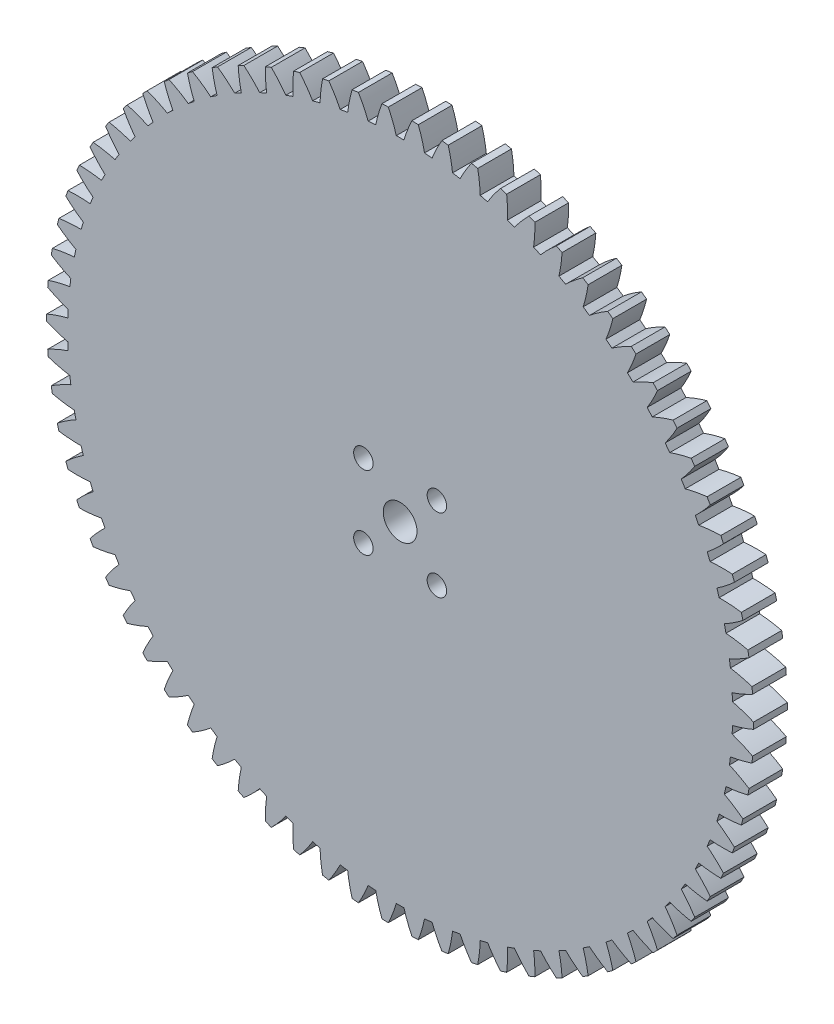
from build123d import *

# Parameters (mm, degrees)
BOSS_EXTRU_1_DEPTH      = 3.175
ENL_V_MAT_EXTRU_1_REACH = 96.233
ESQUISSE2_R             = 3.175
ESQUISSE2_R_2           = 1.83


with BuildPart() as part:
    # Esquisse1 → Boss.-Extru.1 (new, symmetric)
    with BuildSketch(Plane.XY):
        with BuildLine():
            ThreePointArc((62.531470316, -1.938169854), (64.541496389, -1.348612108), (66.497306232, -0.598551441))
            ThreePointArc((66.497306232, -0.598551441), (66.5, 0), (66.497306232, 0.598551441))
            ThreePointArc((66.497306232, 0.598551441), (64.541496389, 1.348612108), (62.531470316, 1.938169854))
            ThreePointArc((62.531470316, 1.938169854), (62.505129974, 2.655185334), (62.470568264, 3.371851574))
            ThreePointArc((62.470568264, 3.371851574), (64.423355205, 4.12974755), (66.308509633, 5.042970377))
            ThreePointArc((66.308509633, 5.042970377), (66.260432988, 5.639593978), (66.206988217, 6.235760683))
            ThreePointArc((66.206988217, 6.235760683), (64.194614612, 6.817254986), (62.141831691, 7.234226724))
            ThreePointArc((62.141831691, 7.234226724), (62.05477908, 7.94642533), (61.959564336, 8.657578734))
            ThreePointArc((61.959564336, 8.657578734), (63.841042271, 9.578352284), (65.641958703, 10.648157479))
            ThreePointArc((65.641958703, 10.648157479), (65.543458038, 11.238554551), (65.439647333, 11.828041126))
            ThreePointArc((65.439647333, 11.828041126), (63.385209166, 12.236779385), (61.304459745, 12.478160825))
            ThreePointArc((61.304459745, 12.478160825), (61.157322081, 13.18041115), (61.002140327, 13.880927841))
            ThreePointArc((61.002140327, 13.880927841), (62.798753164, 14.957944769), (64.502455955, 16.176624362))
            ThreePointArc((64.502455955, 16.176624362), (64.354240971, 16.756541082), (64.200812292, 17.335100262))
            ThreePointArc((64.200812292, 17.335100262), (62.119111835, 17.568137509), (60.025387762, 17.63218949))
            ThreePointArc((60.025387762, 17.63218949), (59.819225175, 18.319431805), (59.6051945, 19.004264545))
            ThreePointArc((59.6051945, 19.004264545), (61.303997602, 20.22976492), (62.898211535, 21.588538295))
            ThreePointArc((62.898211535, 21.588538295), (62.701350123, 22.15379635), (62.499408926, 22.717259603))
            ThreePointArc((62.499408926, 22.717259603), (60.40544488, 22.772916799), (58.313831485, 22.659177827))
            ThreePointArc((58.313831485, 22.659177827), (58.050129381, 23.326460535), (57.77879188, 23.990675087))
            ThreePointArc((57.77879188, 23.990675087), (59.367545333, 25.35582915), (60.840784059, 26.844906316))
            ThreePointArc((60.840784059, 26.844906316), (60.596694611, 27.391433008), (60.347695887, 27.935740568))
            ThreePointArc((60.347695887, 27.935740568), (58.256555311, 27.813616702), (56.182122715, 27.522906268))
            ThreePointArc((56.182122715, 27.522906268), (55.862781075, 28.165421581), (55.536091741, 28.804232266))
            ThreePointArc((55.536091741, 28.804232266), (57.003348538, 30.299204051), (58.34499734, 31.907856171))
            ThreePointArc((58.34499734, 31.907856171), (58.055438525, 32.431713764), (57.761176317, 32.952943882))
            ThreePointArc((57.761176317, 32.952943882), (55.687925925, 32.653918859), (53.645620464, 32.188331539))
            ThreePointArc((53.645620464, 32.188331539), (53.27294015, 32.80145012), (52.893252788, 33.410254291))
            ThreePointArc((52.893252788, 33.410254291), (54.228441312, 35.024272492), (55.428833578, 36.740909192))
            ThreePointArc((55.428833578, 36.740909192), (55.095891675, 37.238323278), (54.758486147, 37.732720481))
            ThreePointArc((54.758486147, 37.732720481), (52.718063758, 37.258948782), (50.722600289, 36.621839143))
            ThreePointArc((50.722600289, 36.621839143), (50.299266471, 37.201143459), (49.869316736, 37.775554668))
            ThreePointArc((49.869316736, 37.775554668), (51.062816923, 39.496990248), (52.113303799, 41.309243119))
            ThreePointArc((52.113303799, 41.309243119), (51.739377662, 41.77662982), (51.36125983, 42.240631964))
            ThreePointArc((51.36125983, 42.240631964), (49.368366733, 41.595527126), (47.434122615, 40.791485557))
            ThreePointArc((47.434122615, 40.791485557), (46.963185425, 41.332801707), (46.486071115, 41.868681309))
            ThreePointArc((46.486071115, 41.868681309), (47.529283768, 43.685131283), (48.422296473, 45.579943004))
            ThreePointArc((48.422296473, 45.579943004), (48.010080248, 46.013934787), (47.593974459, 46.444198725))
            ThreePointArc((47.593974459, 46.444198725), (45.662969494, 45.632408743), (43.803881002, 44.667228383))
            ThreePointArc((43.803881002, 44.667228383), (43.288733552, 45.166656172), (42.767892287, 45.660143141))
            ThreePointArc((42.767892287, 45.660143141), (43.653301034, 47.558519947), (44.382405391, 49.522238355))
            ThreePointArc((44.382405391, 49.522238355), (43.934869105, 49.919708299), (43.483773411, 50.31313397))
            ThreePointArc((43.483773411, 50.31313397), (41.628569514, 49.34050781), (39.858031422, 48.221142805))
            ThreePointArc((39.858031422, 48.221142805), (39.302385361, 48.675083844), (38.741569814, 49.122622595))
            ThreePointArc((38.741569814, 49.122622595), (39.462795266, 51.089248385), (40.022738062, 53.107724843))
            ThreePointArc((40.022738062, 53.107724843), (39.543106224, 53.465809169), (39.06027078, 53.819561933))
            ThreePointArc((39.06027078, 53.819561933), (37.294234736, 52.693107388), (35.625003812, 51.427622788))
            ThreePointArc((35.625003812, 51.427622788), (35.032862583, 51.832806421), (34.436113443, 52.231172428))
            ThreePointArc((34.436113443, 52.231172428), (34.987959154, 54.251877617), (35.374705987, 56.310568958))
            ThreePointArc((35.374705987, 56.310568958), (34.866434357, 56.626687659), (34.355338002, 56.938218718))
            ThreePointArc((34.355338002, 56.938218718), (32.691194142, 55.666051919), (31.135297233, 54.263565571))
            ThreePointArc((31.135297233, 54.263565571), (30.510927227, 54.617072441), (29.882544085, 54.963395467))
            ThreePointArc((29.882544085, 54.963395467), (30.261033995, 57.023620828), (30.471798345, 59.107694132))
            ThreePointArc((30.471798345, 59.107694132), (29.93854903, 59.379569567), (29.402874227, 59.646634333))
            ThreePointArc((29.402874227, 59.646634333), (27.852612746, 58.237921271), (26.421260125, 56.70853812))
            ThreePointArc((26.421260125, 56.70853812), (25.769159942, 57.007821201), (25.113670313, 57.299605982))
            ThreePointArc((25.113670313, 57.299605982), (25.316077392, 59.384507544), (25.349340698, 61.478947016))
            ThreePointArc((25.349340698, 61.478947016), (24.794955772, 61.704620315), (24.238562069, 61.92529458))
            ThreePointArc((24.238562069, 61.92529458), (22.813352637, 60.390185065), (21.516857232, 58.744924352))
            ThreePointArc((21.516857232, 58.744924352), (20.841725269, 58.987827304), (20.163851971, 59.222971522))
            ThreePointArc((20.163851971, 59.222971522), (20.188717871, 61.317527522), (20.04424047, 63.407242677))
            ThreePointArc((20.04424047, 63.407242677), (19.47271429, 63.58508786), (18.899610516, 63.757781661))
            ThreePointArc((18.899610516, 63.757781661), (17.609721799, 62.107336192), (16.457424889, 60.358052058))
            ThreePointArc((16.457424889, 60.358052058), (15.764125487, 60.54282476), (15.068752613, 60.719634196))
            ThreePointArc((15.068752613, 60.719634196), (14.915898176, 62.80875331), (14.594721031, 64.878687703))
            ThreePointArc((14.594721031, 64.878687703), (14.010171455, 65.00742339), (13.424486837, 65.130892464))
            ThreePointArc((13.424486837, 65.130892464), (12.279212512, 63.377002539), (11.279416423, 61.536298616))
            ThreePointArc((11.279416423, 61.536298616), (10.572944821, 61.661609775), (9.865082547, 61.778810515))
            ThreePointArc((9.865082547, 61.778810515), (9.535609092, 63.847440591), (9.040046292, 65.882680296))
            ThreePointArc((9.040046292, 65.882680296), (8.446685013, 65.961378945), (7.852639422, 66.034733695))
            ThreePointArc((7.852639422, 66.034733695), (6.860231217, 64.19003613), (6.020139503, 62.271174733))
            ThreePointArc((6.020139503, 62.271174733), (5.305585844, 62.336121479), (4.590334336, 62.392869087))
            ThreePointArc((4.590334336, 62.392869087), (4.086615726, 64.426105599), (3.420237812, 66.411986669))
            ThreePointArc((3.420237812, 66.411986669), (2.822340013, 66.440081253), (2.22421356, 66.462793156))
            ThreePointArc((2.22421356, 66.462793156), (1.391821799, 64.54057904), (0.71748734, 62.557385608))
            ThreePointArc((0.71748734, 62.557385608), (0, 62.5615), (-0.71748734, 62.557385608))
            ThreePointArc((-0.71748734, 62.557385608), (-1.391821799, 64.54057904), (-2.22421356, 66.462793156))
            ThreePointArc((-2.22421356, 66.462793156), (-2.822340013, 66.440081253), (-3.420237812, 66.411986669))
            ThreePointArc((-3.420237812, 66.411986669), (-4.086615726, 64.426105599), (-4.590334336, 62.392869087))
            ThreePointArc((-4.590334336, 62.392869087), (-5.305585844, 62.336121479), (-6.020139503, 62.271174733))
            ThreePointArc((-6.020139503, 62.271174733), (-6.860231217, 64.19003613), (-7.852639422, 66.034733695))
            ThreePointArc((-7.852639422, 66.034733695), (-8.446685013, 65.961378945), (-9.040046292, 65.882680296))
            ThreePointArc((-9.040046292, 65.882680296), (-9.535609092, 63.847440591), (-9.865082547, 61.778810515))
            ThreePointArc((-9.865082547, 61.778810515), (-10.572944821, 61.661609775), (-11.279416423, 61.536298616))
            ThreePointArc((-11.279416423, 61.536298616), (-12.279212512, 63.377002539), (-13.424486837, 65.130892464))
            ThreePointArc((-13.424486837, 65.130892464), (-14.010171455, 65.00742339), (-14.594721031, 64.878687703))
            ThreePointArc((-14.594721031, 64.878687703), (-14.915898176, 62.80875331), (-15.068752613, 60.719634196))
            ThreePointArc((-15.068752613, 60.719634196), (-15.764125487, 60.54282476), (-16.457424889, 60.358052058))
            ThreePointArc((-16.457424889, 60.358052058), (-17.609721799, 62.107336192), (-18.899610516, 63.757781661))
            ThreePointArc((-18.899610516, 63.757781661), (-19.47271429, 63.58508786), (-20.04424047, 63.407242677))
            ThreePointArc((-20.04424047, 63.407242677), (-20.188717871, 61.317527522), (-20.163851971, 59.222971522))
            ThreePointArc((-20.163851971, 59.222971522), (-20.841725269, 58.987827304), (-21.516857232, 58.744924352))
            ThreePointArc((-21.516857232, 58.744924352), (-22.813352637, 60.390185065), (-24.238562069, 61.92529458))
            ThreePointArc((-24.238562069, 61.92529458), (-24.794955772, 61.704620315), (-25.349340698, 61.478947016))
            ThreePointArc((-25.349340698, 61.478947016), (-25.316077392, 59.384507544), (-25.113670313, 57.299605982))
            ThreePointArc((-25.113670313, 57.299605982), (-25.769159942, 57.007821201), (-26.421260125, 56.70853812))
            ThreePointArc((-26.421260125, 56.70853812), (-27.852612746, 58.237921271), (-29.402874227, 59.646634333))
            ThreePointArc((-29.402874227, 59.646634333), (-29.93854903, 59.379569567), (-30.471798345, 59.107694132))
            ThreePointArc((-30.471798345, 59.107694132), (-30.261033995, 57.023620828), (-29.882544085, 54.963395467))
            ThreePointArc((-29.882544085, 54.963395467), (-30.510927227, 54.617072441), (-31.135297233, 54.263565571))
            ThreePointArc((-31.135297233, 54.263565571), (-32.691194142, 55.666051919), (-34.355338002, 56.938218718))
            ThreePointArc((-34.355338002, 56.938218718), (-34.866434357, 56.626687659), (-35.374705987, 56.310568958))
            ThreePointArc((-35.374705987, 56.310568958), (-34.987959154, 54.251877617), (-34.436113443, 52.231172428))
            ThreePointArc((-34.436113443, 52.231172428), (-35.032862583, 51.832806421), (-35.625003812, 51.427622788))
            ThreePointArc((-35.625003812, 51.427622788), (-37.294234736, 52.693107388), (-39.06027078, 53.819561933))
            ThreePointArc((-39.06027078, 53.819561933), (-39.543106224, 53.465809169), (-40.022738062, 53.107724843))
            ThreePointArc((-40.022738062, 53.107724843), (-39.462795266, 51.089248385), (-38.741569814, 49.122622595))
            ThreePointArc((-38.741569814, 49.122622595), (-39.302385361, 48.675083844), (-39.858031422, 48.221142805))
            ThreePointArc((-39.858031422, 48.221142805), (-41.628569514, 49.34050781), (-43.483773411, 50.31313397))
            ThreePointArc((-43.483773411, 50.31313397), (-43.934869105, 49.919708299), (-44.382405391, 49.522238355))
            ThreePointArc((-44.382405391, 49.522238355), (-43.653301034, 47.558519947), (-42.767892287, 45.660143141))
            ThreePointArc((-42.767892287, 45.660143141), (-43.288733552, 45.166656172), (-43.803881002, 44.667228383))
            ThreePointArc((-43.803881002, 44.667228383), (-45.662969494, 45.632408743), (-47.593974459, 46.444198725))
            ThreePointArc((-47.593974459, 46.444198725), (-48.010080248, 46.013934787), (-48.422296473, 45.579943004))
            ThreePointArc((-48.422296473, 45.579943004), (-47.529283768, 43.685131283), (-46.486071115, 41.868681309))
            ThreePointArc((-46.486071115, 41.868681309), (-46.963185425, 41.332801707), (-47.434122615, 40.791485557))
            ThreePointArc((-47.434122615, 40.791485557), (-49.368366733, 41.595527126), (-51.36125983, 42.240631964))
            ThreePointArc((-51.36125983, 42.240631964), (-51.739377662, 41.77662982), (-52.113303799, 41.309243119))
            ThreePointArc((-52.113303799, 41.309243119), (-51.062816923, 39.496990248), (-49.869316736, 37.775554668))
            ThreePointArc((-49.869316736, 37.775554668), (-50.299266471, 37.201143459), (-50.722600289, 36.621839143))
            ThreePointArc((-50.722600289, 36.621839143), (-52.718063758, 37.258948782), (-54.758486147, 37.732720481))
            ThreePointArc((-54.758486147, 37.732720481), (-55.095891675, 37.238323278), (-55.428833578, 36.740909192))
            ThreePointArc((-55.428833578, 36.740909192), (-54.228441312, 35.024272492), (-52.893252788, 33.410254291))
            ThreePointArc((-52.893252788, 33.410254291), (-53.27294015, 32.80145012), (-53.645620464, 32.188331539))
            ThreePointArc((-53.645620464, 32.188331539), (-55.687925925, 32.653918859), (-57.761176317, 32.952943882))
            ThreePointArc((-57.761176317, 32.952943882), (-58.055438525, 32.431713764), (-58.34499734, 31.907856171))
            ThreePointArc((-58.34499734, 31.907856171), (-57.003348538, 30.299204051), (-55.536091741, 28.804232266))
            ThreePointArc((-55.536091741, 28.804232266), (-55.862781075, 28.165421581), (-56.182122715, 27.522906268))
            ThreePointArc((-56.182122715, 27.522906268), (-58.256555311, 27.813616702), (-60.347695887, 27.935740568))
            ThreePointArc((-60.347695887, 27.935740568), (-60.596694611, 27.391433008), (-60.840784059, 26.844906316))
            ThreePointArc((-60.840784059, 26.844906316), (-59.367545333, 25.35582915), (-57.77879188, 23.990675087))
            ThreePointArc((-57.77879188, 23.990675087), (-58.050129381, 23.326460535), (-58.313831485, 22.659177827))
            ThreePointArc((-58.313831485, 22.659177827), (-60.40544488, 22.772916799), (-62.499408926, 22.717259603))
            ThreePointArc((-62.499408926, 22.717259603), (-62.701350123, 22.15379635), (-62.898211535, 21.588538295))
            ThreePointArc((-62.898211535, 21.588538295), (-61.303997602, 20.22976492), (-59.6051945, 19.004264545))
            ThreePointArc((-59.6051945, 19.004264545), (-59.819225175, 18.319431805), (-60.025387762, 17.63218949))
            ThreePointArc((-60.025387762, 17.63218949), (-62.119111835, 17.568137509), (-64.200812292, 17.335100262))
            ThreePointArc((-64.200812292, 17.335100262), (-64.354240971, 16.756541082), (-64.502455955, 16.176624362))
            ThreePointArc((-64.502455955, 16.176624362), (-62.798753164, 14.957944769), (-61.002140327, 13.880927841))
            ThreePointArc((-61.002140327, 13.880927841), (-61.157322081, 13.18041115), (-61.304459745, 12.478160825))
            ThreePointArc((-61.304459745, 12.478160825), (-63.385209166, 12.236779385), (-65.439647333, 11.828041126))
            ThreePointArc((-65.439647333, 11.828041126), (-65.543458038, 11.238554551), (-65.641958703, 10.648157479))
            ThreePointArc((-65.641958703, 10.648157479), (-63.841042271, 9.578352284), (-61.959564336, 8.657578734))
            ThreePointArc((-61.959564336, 8.657578734), (-62.05477908, 7.94642533), (-62.141831691, 7.234226724))
            ThreePointArc((-62.141831691, 7.234226724), (-64.194614612, 6.817254986), (-66.206988217, 6.235760683))
            ThreePointArc((-66.206988217, 6.235760683), (-66.260432988, 5.639593978), (-66.308509633, 5.042970377))
            ThreePointArc((-66.308509633, 5.042970377), (-64.423355205, 4.12974755), (-62.470568264, 3.371851574))
            ThreePointArc((-62.470568264, 3.371851574), (-62.505129974, 2.655185334), (-62.531470316, 1.938169854))
            ThreePointArc((-62.531470316, 1.938169854), (-64.541496389, 1.348612108), (-66.497306232, 0.598551441))
            ThreePointArc((-66.497306232, 0.598551441), (-66.5, 0), (-66.497306232, -0.598551441))
            ThreePointArc((-66.497306232, -0.598551441), (-64.541496389, -1.348612108), (-62.531470316, -1.938169854))
            ThreePointArc((-62.531470316, -1.938169854), (-62.505129974, -2.655185334), (-62.470568264, -3.371851574))
            ThreePointArc((-62.470568264, -3.371851574), (-64.423355205, -4.12974755), (-66.308509633, -5.042970377))
            ThreePointArc((-66.308509633, -5.042970377), (-66.260432988, -5.639593978), (-66.206988217, -6.235760683))
            ThreePointArc((-66.206988217, -6.235760683), (-64.194614612, -6.817254986), (-62.141831691, -7.234226724))
            ThreePointArc((-62.141831691, -7.234226724), (-62.05477908, -7.94642533), (-61.959564336, -8.657578734))
            ThreePointArc((-61.959564336, -8.657578734), (-63.841042271, -9.578352284), (-65.641958703, -10.648157479))
            ThreePointArc((-65.641958703, -10.648157479), (-65.543458038, -11.238554551), (-65.439647333, -11.828041126))
            ThreePointArc((-65.439647333, -11.828041126), (-63.385209166, -12.236779385), (-61.304459745, -12.478160825))
            ThreePointArc((-61.304459745, -12.478160825), (-61.157322081, -13.18041115), (-61.002140327, -13.880927841))
            ThreePointArc((-61.002140327, -13.880927841), (-62.798753164, -14.957944769), (-64.502455955, -16.176624362))
            ThreePointArc((-64.502455955, -16.176624362), (-64.354240971, -16.756541082), (-64.200812292, -17.335100262))
            ThreePointArc((-64.200812292, -17.335100262), (-62.119111835, -17.568137509), (-60.025387762, -17.63218949))
            ThreePointArc((-60.025387762, -17.63218949), (-59.819225175, -18.319431805), (-59.6051945, -19.004264545))
            ThreePointArc((-59.6051945, -19.004264545), (-61.303997602, -20.22976492), (-62.898211535, -21.588538295))
            ThreePointArc((-62.898211535, -21.588538295), (-62.701350123, -22.15379635), (-62.499408926, -22.717259603))
            ThreePointArc((-62.499408926, -22.717259603), (-60.40544488, -22.772916799), (-58.313831485, -22.659177827))
            ThreePointArc((-58.313831485, -22.659177827), (-58.050129381, -23.326460535), (-57.77879188, -23.990675087))
            ThreePointArc((-57.77879188, -23.990675087), (-59.367545333, -25.35582915), (-60.840784059, -26.844906316))
            ThreePointArc((-60.840784059, -26.844906316), (-60.596694611, -27.391433008), (-60.347695887, -27.935740568))
            ThreePointArc((-60.347695887, -27.935740568), (-58.256555311, -27.813616702), (-56.182122715, -27.522906268))
            ThreePointArc((-56.182122715, -27.522906268), (-55.862781075, -28.165421581), (-55.536091741, -28.804232266))
            ThreePointArc((-55.536091741, -28.804232266), (-57.003348538, -30.299204051), (-58.34499734, -31.907856171))
            ThreePointArc((-58.34499734, -31.907856171), (-58.055438525, -32.431713764), (-57.761176317, -32.952943882))
            ThreePointArc((-57.761176317, -32.952943882), (-55.687925925, -32.653918859), (-53.645620464, -32.188331539))
            ThreePointArc((-53.645620464, -32.188331539), (-53.27294015, -32.80145012), (-52.893252788, -33.410254291))
            ThreePointArc((-52.893252788, -33.410254291), (-54.228441312, -35.024272492), (-55.428833578, -36.740909192))
            ThreePointArc((-55.428833578, -36.740909192), (-55.095891675, -37.238323278), (-54.758486147, -37.732720481))
            ThreePointArc((-54.758486147, -37.732720481), (-52.718063758, -37.258948782), (-50.722600289, -36.621839143))
            ThreePointArc((-50.722600289, -36.621839143), (-50.299266471, -37.201143459), (-49.869316736, -37.775554668))
            ThreePointArc((-49.869316736, -37.775554668), (-51.062816923, -39.496990248), (-52.113303799, -41.309243119))
            ThreePointArc((-52.113303799, -41.309243119), (-51.739377662, -41.77662982), (-51.36125983, -42.240631964))
            ThreePointArc((-51.36125983, -42.240631964), (-49.368366733, -41.595527126), (-47.434122615, -40.791485557))
            ThreePointArc((-47.434122615, -40.791485557), (-46.963185425, -41.332801707), (-46.486071115, -41.868681309))
            ThreePointArc((-46.486071115, -41.868681309), (-47.529283768, -43.685131283), (-48.422296473, -45.579943004))
            ThreePointArc((-48.422296473, -45.579943004), (-48.010080248, -46.013934787), (-47.593974459, -46.444198725))
            ThreePointArc((-47.593974459, -46.444198725), (-45.662969494, -45.632408743), (-43.803881002, -44.667228383))
            ThreePointArc((-43.803881002, -44.667228383), (-43.288733552, -45.166656172), (-42.767892287, -45.660143141))
            ThreePointArc((-42.767892287, -45.660143141), (-43.653301034, -47.558519947), (-44.382405391, -49.522238355))
            ThreePointArc((-44.382405391, -49.522238355), (-43.934869105, -49.919708299), (-43.483773411, -50.31313397))
            ThreePointArc((-43.483773411, -50.31313397), (-41.628569514, -49.34050781), (-39.858031422, -48.221142805))
            ThreePointArc((-39.858031422, -48.221142805), (-39.302385361, -48.675083844), (-38.741569814, -49.122622595))
            ThreePointArc((-38.741569814, -49.122622595), (-39.462795266, -51.089248385), (-40.022738062, -53.107724843))
            ThreePointArc((-40.022738062, -53.107724843), (-39.543106224, -53.465809169), (-39.06027078, -53.819561933))
            ThreePointArc((-39.06027078, -53.819561933), (-37.294234736, -52.693107388), (-35.625003812, -51.427622788))
            ThreePointArc((-35.625003812, -51.427622788), (-35.032862583, -51.832806421), (-34.436113443, -52.231172428))
            ThreePointArc((-34.436113443, -52.231172428), (-34.987959154, -54.251877617), (-35.374705987, -56.310568958))
            ThreePointArc((-35.374705987, -56.310568958), (-34.866434357, -56.626687659), (-34.355338002, -56.938218718))
            ThreePointArc((-34.355338002, -56.938218718), (-32.691194142, -55.666051919), (-31.135297233, -54.263565571))
            ThreePointArc((-31.135297233, -54.263565571), (-30.510927227, -54.617072441), (-29.882544085, -54.963395467))
            ThreePointArc((-29.882544085, -54.963395467), (-30.261033995, -57.023620828), (-30.471798345, -59.107694132))
            ThreePointArc((-30.471798345, -59.107694132), (-29.93854903, -59.379569567), (-29.402874227, -59.646634333))
            ThreePointArc((-29.402874227, -59.646634333), (-27.852612746, -58.237921271), (-26.421260125, -56.70853812))
            ThreePointArc((-26.421260125, -56.70853812), (-25.769159942, -57.007821201), (-25.113670313, -57.299605982))
            ThreePointArc((-25.113670313, -57.299605982), (-25.316077392, -59.384507544), (-25.349340698, -61.478947016))
            ThreePointArc((-25.349340698, -61.478947016), (-24.794955772, -61.704620315), (-24.238562069, -61.92529458))
            ThreePointArc((-24.238562069, -61.92529458), (-22.813352637, -60.390185065), (-21.516857232, -58.744924352))
            ThreePointArc((-21.516857232, -58.744924352), (-20.841725269, -58.987827304), (-20.163851971, -59.222971522))
            ThreePointArc((-20.163851971, -59.222971522), (-20.188717871, -61.317527522), (-20.04424047, -63.407242677))
            ThreePointArc((-20.04424047, -63.407242677), (-19.47271429, -63.58508786), (-18.899610516, -63.757781661))
            ThreePointArc((-18.899610516, -63.757781661), (-17.609721799, -62.107336192), (-16.457424889, -60.358052058))
            ThreePointArc((-16.457424889, -60.358052058), (-15.764125487, -60.54282476), (-15.068752613, -60.719634196))
            ThreePointArc((-15.068752613, -60.719634196), (-14.915898176, -62.80875331), (-14.594721031, -64.878687703))
            ThreePointArc((-14.594721031, -64.878687703), (-14.010171455, -65.00742339), (-13.424486837, -65.130892464))
            ThreePointArc((-13.424486837, -65.130892464), (-12.279212512, -63.377002539), (-11.279416423, -61.536298616))
            ThreePointArc((-11.279416423, -61.536298616), (-10.572944821, -61.661609775), (-9.865082547, -61.778810515))
            ThreePointArc((-9.865082547, -61.778810515), (-9.535609092, -63.847440591), (-9.040046292, -65.882680296))
            ThreePointArc((-9.040046292, -65.882680296), (-8.446685013, -65.961378945), (-7.852639422, -66.034733695))
            ThreePointArc((-7.852639422, -66.034733695), (-6.860231217, -64.19003613), (-6.020139503, -62.271174733))
            ThreePointArc((-6.020139503, -62.271174733), (-5.305585844, -62.336121479), (-4.590334336, -62.392869087))
            ThreePointArc((-4.590334336, -62.392869087), (-4.086615726, -64.426105599), (-3.420237812, -66.411986669))
            ThreePointArc((-3.420237812, -66.411986669), (-2.822340013, -66.440081253), (-2.22421356, -66.462793156))
            ThreePointArc((-2.22421356, -66.462793156), (-1.391821799, -64.54057904), (-0.71748734, -62.557385608))
            ThreePointArc((-0.71748734, -62.557385608), (0, -62.5615), (0.71748734, -62.557385608))
            ThreePointArc((0.71748734, -62.557385608), (1.391821799, -64.54057904), (2.22421356, -66.462793156))
            ThreePointArc((2.22421356, -66.462793156), (2.822340013, -66.440081253), (3.420237812, -66.411986669))
            ThreePointArc((3.420237812, -66.411986669), (4.086615726, -64.426105599), (4.590334336, -62.392869087))
            ThreePointArc((4.590334336, -62.392869087), (5.305585844, -62.336121479), (6.020139503, -62.271174733))
            ThreePointArc((6.020139503, -62.271174733), (6.860231217, -64.19003613), (7.852639422, -66.034733695))
            ThreePointArc((7.852639422, -66.034733695), (8.446685013, -65.961378945), (9.040046292, -65.882680296))
            ThreePointArc((9.040046292, -65.882680296), (9.535609092, -63.847440591), (9.865082547, -61.778810515))
            ThreePointArc((9.865082547, -61.778810515), (10.572944821, -61.661609775), (11.279416423, -61.536298616))
            ThreePointArc((11.279416423, -61.536298616), (12.279212512, -63.377002539), (13.424486837, -65.130892464))
            ThreePointArc((13.424486837, -65.130892464), (14.010171455, -65.00742339), (14.594721031, -64.878687703))
            ThreePointArc((14.594721031, -64.878687703), (14.915898176, -62.80875331), (15.068752613, -60.719634196))
            ThreePointArc((15.068752613, -60.719634196), (15.764125487, -60.54282476), (16.457424889, -60.358052058))
            ThreePointArc((16.457424889, -60.358052058), (17.609721799, -62.107336192), (18.899610516, -63.757781661))
            ThreePointArc((18.899610516, -63.757781661), (19.47271429, -63.58508786), (20.04424047, -63.407242677))
            ThreePointArc((20.04424047, -63.407242677), (20.188717871, -61.317527522), (20.163851971, -59.222971522))
            ThreePointArc((20.163851971, -59.222971522), (20.841725269, -58.987827304), (21.516857232, -58.744924352))
            ThreePointArc((21.516857232, -58.744924352), (22.813352637, -60.390185065), (24.238562069, -61.92529458))
            ThreePointArc((24.238562069, -61.92529458), (24.794955772, -61.704620315), (25.349340698, -61.478947016))
            ThreePointArc((25.349340698, -61.478947016), (25.316077392, -59.384507544), (25.113670313, -57.299605982))
            ThreePointArc((25.113670313, -57.299605982), (25.769159942, -57.007821201), (26.421260125, -56.70853812))
            ThreePointArc((26.421260125, -56.70853812), (27.852612746, -58.237921271), (29.402874227, -59.646634333))
            ThreePointArc((29.402874227, -59.646634333), (29.93854903, -59.379569567), (30.471798345, -59.107694132))
            ThreePointArc((30.471798345, -59.107694132), (30.261033995, -57.023620828), (29.882544085, -54.963395467))
            ThreePointArc((29.882544085, -54.963395467), (30.510927227, -54.617072441), (31.135297233, -54.263565571))
            ThreePointArc((31.135297233, -54.263565571), (32.691194142, -55.666051919), (34.355338002, -56.938218718))
            ThreePointArc((34.355338002, -56.938218718), (34.866434357, -56.626687659), (35.374705987, -56.310568958))
            ThreePointArc((35.374705987, -56.310568958), (34.987959154, -54.251877617), (34.436113443, -52.231172428))
            ThreePointArc((34.436113443, -52.231172428), (35.032862583, -51.832806421), (35.625003812, -51.427622788))
            ThreePointArc((35.625003812, -51.427622788), (37.294234736, -52.693107388), (39.06027078, -53.819561933))
            ThreePointArc((39.06027078, -53.819561933), (39.543106224, -53.465809169), (40.022738062, -53.107724843))
            ThreePointArc((40.022738062, -53.107724843), (39.462795266, -51.089248385), (38.741569814, -49.122622595))
            ThreePointArc((38.741569814, -49.122622595), (39.302385361, -48.675083844), (39.858031422, -48.221142805))
            ThreePointArc((39.858031422, -48.221142805), (41.628569514, -49.34050781), (43.483773411, -50.31313397))
            ThreePointArc((43.483773411, -50.31313397), (43.934869105, -49.919708299), (44.382405391, -49.522238355))
            ThreePointArc((44.382405391, -49.522238355), (43.653301034, -47.558519947), (42.767892287, -45.660143141))
            ThreePointArc((42.767892287, -45.660143141), (43.288733552, -45.166656172), (43.803881002, -44.667228383))
            ThreePointArc((43.803881002, -44.667228383), (45.662969494, -45.632408743), (47.593974459, -46.444198725))
            ThreePointArc((47.593974459, -46.444198725), (48.010080248, -46.013934787), (48.422296473, -45.579943004))
            ThreePointArc((48.422296473, -45.579943004), (47.529283768, -43.685131283), (46.486071115, -41.868681309))
            ThreePointArc((46.486071115, -41.868681309), (46.963185425, -41.332801707), (47.434122615, -40.791485557))
            ThreePointArc((47.434122615, -40.791485557), (49.368366733, -41.595527126), (51.36125983, -42.240631964))
            ThreePointArc((51.36125983, -42.240631964), (51.739377662, -41.77662982), (52.113303799, -41.309243119))
            ThreePointArc((52.113303799, -41.309243119), (51.062816923, -39.496990248), (49.869316736, -37.775554668))
            ThreePointArc((49.869316736, -37.775554668), (50.299266471, -37.201143459), (50.722600289, -36.621839143))
            ThreePointArc((50.722600289, -36.621839143), (52.718063758, -37.258948782), (54.758486147, -37.732720481))
            ThreePointArc((54.758486147, -37.732720481), (55.095891675, -37.238323278), (55.428833578, -36.740909192))
            ThreePointArc((55.428833578, -36.740909192), (54.228441312, -35.024272492), (52.893252788, -33.410254291))
            ThreePointArc((52.893252788, -33.410254291), (53.27294015, -32.80145012), (53.645620464, -32.188331539))
            ThreePointArc((53.645620464, -32.188331539), (55.687925925, -32.653918859), (57.761176317, -32.952943882))
            ThreePointArc((57.761176317, -32.952943882), (58.055438525, -32.431713764), (58.34499734, -31.907856171))
            ThreePointArc((58.34499734, -31.907856171), (57.003348538, -30.299204051), (55.536091741, -28.804232266))
            ThreePointArc((55.536091741, -28.804232266), (55.862781075, -28.165421581), (56.182122715, -27.522906268))
            ThreePointArc((56.182122715, -27.522906268), (58.256555311, -27.813616702), (60.347695887, -27.935740568))
            ThreePointArc((60.347695887, -27.935740568), (60.596694611, -27.391433008), (60.840784059, -26.844906316))
            ThreePointArc((60.840784059, -26.844906316), (59.367545333, -25.35582915), (57.77879188, -23.990675087))
            ThreePointArc((57.77879188, -23.990675087), (58.050129381, -23.326460535), (58.313831485, -22.659177827))
            ThreePointArc((58.313831485, -22.659177827), (60.40544488, -22.772916799), (62.499408926, -22.717259603))
            ThreePointArc((62.499408926, -22.717259603), (62.701350123, -22.15379635), (62.898211535, -21.588538295))
            ThreePointArc((62.898211535, -21.588538295), (61.303997602, -20.22976492), (59.6051945, -19.004264545))
            ThreePointArc((59.6051945, -19.004264545), (59.819225175, -18.319431805), (60.025387762, -17.63218949))
            ThreePointArc((60.025387762, -17.63218949), (62.119111835, -17.568137509), (64.200812292, -17.335100262))
            ThreePointArc((64.200812292, -17.335100262), (64.354240971, -16.756541082), (64.502455955, -16.176624362))
            ThreePointArc((64.502455955, -16.176624362), (62.798753164, -14.957944769), (61.002140327, -13.880927841))
            ThreePointArc((61.002140327, -13.880927841), (61.157322081, -13.18041115), (61.304459745, -12.478160825))
            ThreePointArc((61.304459745, -12.478160825), (63.385209166, -12.236779385), (65.439647333, -11.828041126))
            ThreePointArc((65.439647333, -11.828041126), (65.543458038, -11.238554551), (65.641958703, -10.648157479))
            ThreePointArc((65.641958703, -10.648157479), (63.841042271, -9.578352284), (61.959564336, -8.657578734))
            ThreePointArc((61.959564336, -8.657578734), (62.05477908, -7.94642533), (62.141831691, -7.234226724))
            ThreePointArc((62.141831691, -7.234226724), (64.194614612, -6.817254986), (66.206988217, -6.235760683))
            ThreePointArc((66.206988217, -6.235760683), (66.260432988, -5.639593978), (66.308509633, -5.042970377))
            ThreePointArc((66.308509633, -5.042970377), (64.423355205, -4.12974755), (62.470568264, -3.371851574))
            ThreePointArc((62.470568264, -3.371851574), (62.505129974, -2.655185334), (62.531470316, -1.938169854))
        make_face()
    extrude(amount=BOSS_EXTRU_1_DEPTH, both=True)

    # Esquisse2 → Enlèv. mat.-Extru.1 (cut, up to next)
    with BuildSketch(Plane.XY.offset(3.175), mode=Mode.PRIVATE) as enl_v_mat_extru_1_sk1:
        Circle(ESQUISSE2_R)
    enl_v_mat_extru_1_tool1 = extrude(enl_v_mat_extru_1_sk1.sketch, amount=-ENL_V_MAT_EXTRU_1_REACH, mode=Mode.PRIVATE) & part.part
    # Esquisse2 → Enlèv. mat.-Extru.1 (cut, up to next)
    with BuildSketch(Plane.XY.offset(3.175), mode=Mode.PRIVATE) as enl_v_mat_extru_1_sk2:
        with Locations((6.914797213, 6.914797213)):
            Circle(ESQUISSE2_R_2)
    enl_v_mat_extru_1_tool2 = extrude(enl_v_mat_extru_1_sk2.sketch, amount=-ENL_V_MAT_EXTRU_1_REACH, mode=Mode.PRIVATE) & part.part
    # Esquisse2 → Enlèv. mat.-Extru.1 (cut, up to next)
    with BuildSketch(Plane.XY.offset(3.175), mode=Mode.PRIVATE) as enl_v_mat_extru_1_sk3:
        with Locations((6.914797213, -6.914797213)):
            Circle(ESQUISSE2_R_2)
    enl_v_mat_extru_1_tool3 = extrude(enl_v_mat_extru_1_sk3.sketch, amount=-ENL_V_MAT_EXTRU_1_REACH, mode=Mode.PRIVATE) & part.part
    # Esquisse2 → Enlèv. mat.-Extru.1 (cut, up to next)
    with BuildSketch(Plane.XY.offset(3.175), mode=Mode.PRIVATE) as enl_v_mat_extru_1_sk4:
        with Locations((-6.914797213, -6.914797213)):
            Circle(ESQUISSE2_R_2)
    enl_v_mat_extru_1_tool4 = extrude(enl_v_mat_extru_1_sk4.sketch, amount=-ENL_V_MAT_EXTRU_1_REACH, mode=Mode.PRIVATE) & part.part
    # Esquisse2 → Enlèv. mat.-Extru.1 (cut, up to next)
    with BuildSketch(Plane.XY.offset(3.175), mode=Mode.PRIVATE) as enl_v_mat_extru_1_sk5:
        with Locations((-6.914797213, 6.914797213)):
            Circle(ESQUISSE2_R_2)
    enl_v_mat_extru_1_tool5 = extrude(enl_v_mat_extru_1_sk5.sketch, amount=-ENL_V_MAT_EXTRU_1_REACH, mode=Mode.PRIVATE) & part.part
    add(enl_v_mat_extru_1_tool1.solids().sort_by_distance((0, 0, 3.175))[0], mode=Mode.SUBTRACT)
    add(enl_v_mat_extru_1_tool2.solids().sort_by_distance((6.914797, 6.914797, 3.175))[0], mode=Mode.SUBTRACT)
    add(enl_v_mat_extru_1_tool3.solids().sort_by_distance((6.914797, -6.914797, 3.175))[0], mode=Mode.SUBTRACT)
    add(enl_v_mat_extru_1_tool4.solids().sort_by_distance((-6.914797, -6.914797, 3.175))[0], mode=Mode.SUBTRACT)
    add(enl_v_mat_extru_1_tool5.solids().sort_by_distance((-6.914797, 6.914797, 3.175))[0], mode=Mode.SUBTRACT)


solid = part.part
